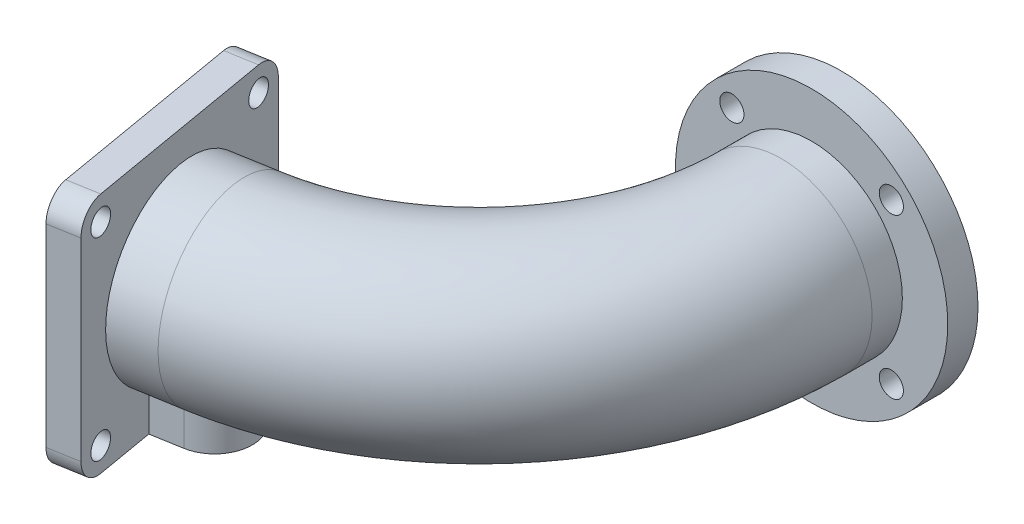
from build123d import *

# Parameters (mm, degrees)
SKETCH1_R           = 22.5
SKETCH1_R_2         = 15
SKETCH1_R_3         = 2
BOSS_EXTRUDE1_DEPTH = 5
SKETCH4_R           = 15
SKETCH4_R_2         = 10
SKETCH5_W           = 40
SKETCH5_H           = 40
SKETCH5_R           = 10
SKETCH5_R_2         = 2
BOSS_EXTRUDE2_DEPTH = 5
FILLET1_R           = 4
SKETCH6_R           = 3
BOSS_EXTRUDE3_DEPTH = 7


with BuildPart() as part:
    # Sketch1 → Boss-Extrude1 (new body)
    with BuildSketch(Plane.XY):
        Circle(SKETCH1_R)
        Circle(SKETCH1_R_2, mode=Mode.SUBTRACT)
        with Locations((13.177680547, 13.177680547)):
            Circle(SKETCH1_R_3, mode=Mode.SUBTRACT)
        with Locations((13.177680547, -13.177680547)):
            Circle(SKETCH1_R_3, mode=Mode.SUBTRACT)
        with Locations((-13.177680547, -13.177680547)):
            Circle(SKETCH1_R_3, mode=Mode.SUBTRACT)
        with Locations((-13.177680547, 13.177680547)):
            Circle(SKETCH1_R_3, mode=Mode.SUBTRACT)
    extrude(amount=BOSS_EXTRUDE1_DEPTH)

    # Sweep1: sweep along a path in Sketch3
    with BuildLine(Plane(origin=(0, 0, 0), x_dir=(1, 0, 0), z_dir=(0, 1, 0))) as sweep1_path:
        Line((0, 2.5), (0, -10))
        ThreePointArc((0, -10), (-11.757890636, -42.210884362), (-41.501642855, -59.272486499))
        Line((-41.501642855, -59.272486499), (-53.81976448, -61.397075786))
    # Sketch4 → Sweep1 (sweep)
    with BuildSketch(Plane(origin=(-53.81976448, 0, 61.397075786), x_dir=(0.16996714290024248, 0, 0.98544972998846), z_dir=(-0.98544972998846, 0, 0.16996714290024248))):
        Circle(SKETCH4_R)
        Circle(SKETCH4_R_2, mode=Mode.SUBTRACT)
    sweep(path=sweep1_path.line)

    # Sketch5 → Boss-Extrude2 (add)
    with BuildSketch(Plane(origin=(-62.548620892, 0, 10.788181337), x_dir=(0.16996714290024248, 0, 0.98544972998846), z_dir=(-0.98544972998846, 0, 0.16996714290024248))):
        with Locations((51.356140155, 0)):
            Rectangle(SKETCH5_W, SKETCH5_H)
        with Locations((51.356140155, 0)):
            Circle(SKETCH5_R, mode=Mode.SUBTRACT)
        with Locations((67.356140155, 16)):
            Circle(SKETCH5_R_2, mode=Mode.SUBTRACT)
        with Locations((35.356140155, 16)):
            Circle(SKETCH5_R_2, mode=Mode.SUBTRACT)
        with Locations((35.356140155, -16)):
            Circle(SKETCH5_R_2, mode=Mode.SUBTRACT)
        with Locations((67.356140155, -16)):
            Circle(SKETCH5_R_2, mode=Mode.SUBTRACT)
    extrude(amount=-BOSS_EXTRUDE2_DEPTH)

    # Fillet1
    fillet1_edges = [part.edges().sort_by_distance(p)[0] for p in [
        (-47.956797297, 20, 80.681152528),
        (-47.956797297, -20, 80.681152528),
        (-54.755483013, -20, 41.263163329),
        (-54.755483013, 20, 41.263163329),
    ]]
    fillet(fillet1_edges, radius=FILLET1_R)

    # Sketch6 → Boss-Extrude3 (add)
    with BuildSketch(Plane(origin=(0, -20, 0), x_dir=(-1, 0, 0), z_dir=(0, -1, 0))):
        with BuildLine():
            Line((48.89251583, -60.547240071), (47.830221187, -66.706300884))
            Line((47.830221187, -66.706300884), (42.902972537, -65.856465169))
            ThreePointArc((42.902972537, -65.856465169), (37.806206368, -58.635109714), (45.027561823, -53.538343544))
            Line((45.027561823, -53.538343544), (49.954810473, -54.388179259))
            Line((49.954810473, -54.388179259), (48.89251583, -60.547240071))
        make_face()
        with Locations(Location((43.96526718, -59.697404357, 0), (0, 0, 90))):
            Circle(SKETCH6_R, mode=Mode.SUBTRACT)
    extrude(amount=-BOSS_EXTRUDE3_DEPTH)


solid = part.part
